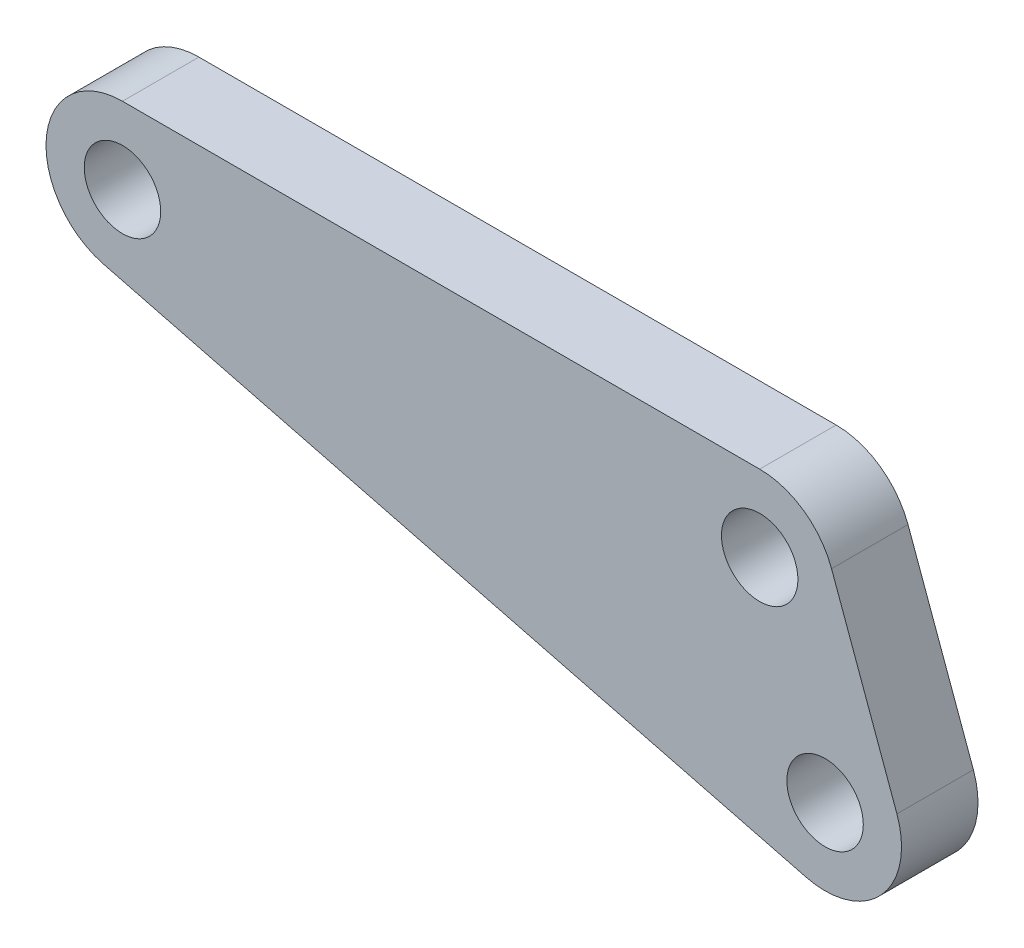
from build123d import *

# Parameters (mm, degrees)
SKETCH2_R           = 1.5
BOSS_EXTRUDE1_DEPTH = 3


with BuildPart() as part:
    # Sketch2 → Boss-Extrude1 (new body)
    with BuildSketch(Plane.XY):
        with BuildLine():
            Line((-25, 3), (0, 3))
            ThreePointArc((0, 3), (1.720729309, 2.457456133), (2.819077862, 1.02606043))
            Line((2.819077862, 1.02606043), (5.384228937, -6.021634226))
            ThreePointArc((5.384228937, -6.021634226), (4.788587885, -9.061727613), (1.822032903, -9.954200356))
            Line((1.822032903, -9.954200356), (-25.743118172, -2.9065057))
            ThreePointArc((-25.743118172, -2.9065057), (-27.976534655, 0.374488252), (-25, 3))
        make_face()
        with Locations((-25, 0)):
            Circle(SKETCH2_R, mode=Mode.SUBTRACT)
        Circle(SKETCH2_R, mode=Mode.SUBTRACT)
        with Locations((2.565151075, -7.047694656)):
            Circle(SKETCH2_R, mode=Mode.SUBTRACT)
    extrude(amount=BOSS_EXTRUDE1_DEPTH)


solid = part.part
